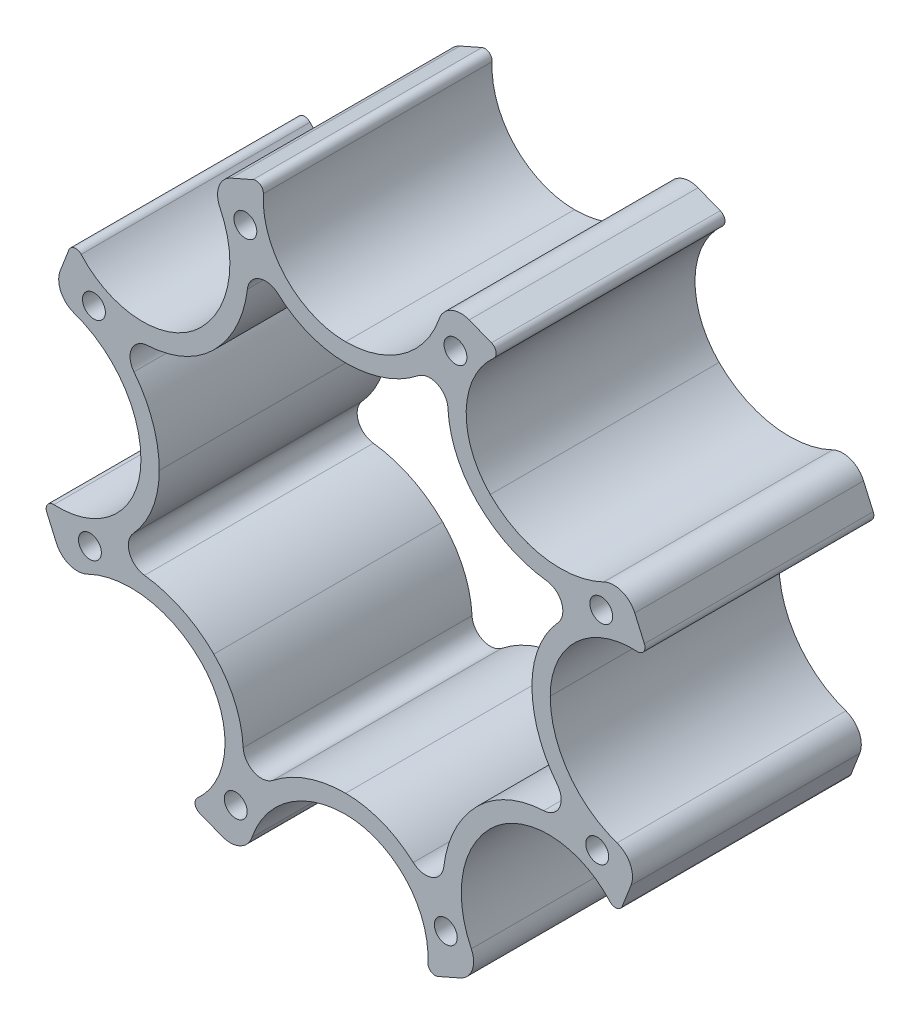
from build123d import *

# Parameters (mm, degrees)
EXTRUDE_1_DEPTH        = 25
CUT_EXTRUDE_1_DEPTH    = 53.585134746
EXTRUDE_2_DEPTH        = 4
SKETCH_4_R             = 3.5
SKETCH_4_R_2           = 1.7
SKETCH_4_R_3           = 2.3
CUT_EXTRUDE_2_DEPTH    = 55.600333298
SKETCH_5_R             = 50
CUT_EXTRUDE_3_DEPTH    = 4
HOLE_WIZARD_M3_1_D     = 2.5
HOLE_WIZARD_M3_1_DEPTH = 11.5
HOLE_WIZARD_M3_1_TIP   = 0.751075774


with BuildPart() as part:
    # 草图1 → 凸台-拉伸1 (new body)
    with BuildSketch(Plane.XY):
        with BuildLine():
            Line((15.936762996, 30.229618981), (13.50337588, 31.175538906))
            ThreePointArc((13.50337588, 31.175538906), (11.545587701, 31.113280948), (10.233613318, 29.658793469))
            ThreePointArc((10.233613318, 29.658793469), (6.285609854, 24.369935979), (0, 22.357511157))
            ThreePointArc((0, 22.357511157), (-6.541634269, 25.176328334), (-8.985563862, 31.867062025))
            ThreePointArc((-8.985563862, 31.867062025), (-9.328351981, 32.569720668), (-10.106575389, 32.644561759))
            Line((-10.106575389, 32.644561759), (-12.496106314, 31.592763621))
            ThreePointArc((-12.496106314, 31.592763621), (-13.836448588, 30.1643753), (-13.73567661, 28.208191357))
            ThreePointArc((-13.73567661, 28.208191357), (-12.787549636, 21.67674434), (-15.80914775, 15.80914775))
            ThreePointArc((-15.80914775, 15.80914775), (-22.427986442, 13.176718539), (-28.887168794, 16.179662515))
            ThreePointArc((-28.887168794, 16.179662515), (-29.626411288, 16.434129403), (-30.229618981, 15.936762996))
            Line((-30.229618981, 15.936762996), (-31.175538906, 13.50337588))
            ThreePointArc((-31.175538906, 13.50337588), (-31.113280948, 11.545587701), (-29.658793469, 10.233613318))
            ThreePointArc((-29.658793469, 10.233613318), (-24.369935979, 6.285609854), (-22.357511157, 0))
            ThreePointArc((-22.357511157, 0), (-25.176328334, -6.541634269), (-31.867062025, -8.985563862))
            ThreePointArc((-31.867062025, -8.985563862), (-32.569720668, -9.328351981), (-32.644561759, -10.106575389))
            Line((-32.644561759, -10.106575389), (-31.592763621, -12.496106314))
            ThreePointArc((-31.592763621, -12.496106314), (-30.1643753, -13.836448588), (-28.208191357, -13.73567661))
            ThreePointArc((-28.208191357, -13.73567661), (-21.67674434, -12.787549636), (-15.80914775, -15.80914775))
            ThreePointArc((-15.80914775, -15.80914775), (-13.176718539, -22.427986442), (-16.179662515, -28.887168794))
            ThreePointArc((-16.179662515, -28.887168794), (-16.434129403, -29.626411288), (-15.936762996, -30.229618981))
            Line((-15.936762996, -30.229618981), (-13.50337588, -31.175538906))
            ThreePointArc((-13.50337588, -31.175538906), (-11.545587701, -31.113280948), (-10.233613318, -29.658793469))
            ThreePointArc((-10.233613318, -29.658793469), (-6.285609854, -24.369935979), (0, -22.357511157))
            ThreePointArc((0, -22.357511157), (6.541634269, -25.176328334), (8.985563862, -31.867062025))
            ThreePointArc((8.985563862, -31.867062025), (9.328351981, -32.569720668), (10.106575389, -32.644561759))
            Line((10.106575389, -32.644561759), (12.496106314, -31.592763621))
            ThreePointArc((12.496106314, -31.592763621), (13.836448588, -30.1643753), (13.73567661, -28.208191357))
            ThreePointArc((13.73567661, -28.208191357), (12.787549636, -21.67674434), (15.80914775, -15.80914775))
            ThreePointArc((15.80914775, -15.80914775), (22.427986442, -13.176718539), (28.887168794, -16.179662515))
            ThreePointArc((28.887168794, -16.179662515), (29.626411288, -16.434129403), (30.229618981, -15.936762996))
            Line((30.229618981, -15.936762996), (31.175538906, -13.50337588))
            ThreePointArc((31.175538906, -13.50337588), (31.113280948, -11.545587701), (29.658793469, -10.233613318))
            ThreePointArc((29.658793469, -10.233613318), (24.369935979, -6.285609854), (22.357511157, 0))
            ThreePointArc((22.357511157, 0), (25.176328334, 6.541634269), (31.867062025, 8.985563862))
            ThreePointArc((31.867062025, 8.985563862), (32.569720668, 9.328351981), (32.644561759, 10.106575389))
            Line((32.644561759, 10.106575389), (31.592763621, 12.496106314))
            ThreePointArc((31.592763621, 12.496106314), (30.1643753, 13.836448588), (28.208191357, 13.73567661))
            ThreePointArc((28.208191357, 13.73567661), (21.67674434, 12.787549636), (15.80914775, 15.80914775))
            ThreePointArc((15.80914775, 15.80914775), (13.176718539, 22.427986442), (16.179662515, 28.887168794))
            ThreePointArc((16.179662515, 28.887168794), (16.434129403, 29.626411288), (15.936762996, 30.229618981))
        make_face()
    extrude(amount=EXTRUDE_1_DEPTH)

    # 草图2 → 切除-拉伸1 (cut, through all)
    with BuildSketch(Plane(origin=(0, 0, 0), x_dir=(-1, 0, 0), z_dir=(0, 0, -1))):
        with BuildLine():
            ThreePointArc((20.357511157, 0), (21.09666185, -3.964211334), (23.214778703, -7.395668204))
            ThreePointArc((23.214778703, -7.395668204), (23.607260601, -9.441727167), (21.96737362, -10.726705772))
            ThreePointArc((21.96737362, -10.726705772), (17.87170053, -11.922005636), (14.394934187, -14.394934187))
            ThreePointArc((14.394934187, -14.394934187), (12.114471938, -17.720713371), (11.185800306, -21.644854583))
            ThreePointArc((11.185800306, -21.644854583), (10.01654475, -23.369163362), (7.948352461, -23.118205243))
            ThreePointArc((7.948352461, -23.118205243), (4.207069606, -21.067331667), (0, -20.357511157))
            ThreePointArc((0, -20.357511157), (-3.964211334, -21.09666185), (-7.395668204, -23.214778703))
            ThreePointArc((-7.395668204, -23.214778703), (-9.441727167, -23.607260601), (-10.726705772, -21.96737362))
            ThreePointArc((-10.726705772, -21.96737362), (-11.922005636, -17.87170053), (-14.394934187, -14.394934187))
            ThreePointArc((-14.394934187, -14.394934187), (-17.720713371, -12.114471938), (-21.644854583, -11.185800306))
            ThreePointArc((-21.644854583, -11.185800306), (-23.369163362, -10.01654475), (-23.118205243, -7.948352461))
            ThreePointArc((-23.118205243, -7.948352461), (-21.067331667, -4.207069606), (-20.357511157, 0))
            ThreePointArc((-20.357511157, 0), (-21.09666185, 3.964211334), (-23.214778703, 7.395668204))
            ThreePointArc((-23.214778703, 7.395668204), (-23.607260601, 9.441727167), (-21.96737362, 10.726705772))
            ThreePointArc((-21.96737362, 10.726705772), (-17.87170053, 11.922005636), (-14.394934187, 14.394934187))
            ThreePointArc((-14.394934187, 14.394934187), (-12.114471938, 17.720713371), (-11.185800306, 21.644854583))
            ThreePointArc((-11.185800306, 21.644854583), (-10.01654475, 23.369163362), (-7.948352461, 23.118205243))
            ThreePointArc((-7.948352461, 23.118205243), (-4.207069606, 21.067331667), (0, 20.357511157))
            ThreePointArc((0, 20.357511157), (3.964211334, 21.09666185), (7.395668204, 23.214778703))
            ThreePointArc((7.395668204, 23.214778703), (9.441727167, 23.607260601), (10.726705772, 21.96737362))
            ThreePointArc((10.726705772, 21.96737362), (11.922005636, 17.87170053), (14.394934187, 14.394934187))
            ThreePointArc((14.394934187, 14.394934187), (17.720713371, 12.114471938), (21.644854583, 11.185800306))
            ThreePointArc((21.644854583, 11.185800306), (23.369163362, 10.01654475), (23.118205243, 7.948352461))
            ThreePointArc((23.118205243, 7.948352461), (21.067331667, 4.207069606), (20.357511157, 0))
        make_face()
    extrude(amount=-CUT_EXTRUDE_1_DEPTH, mode=Mode.SUBTRACT)

    # 草图3 → 凸台-拉伸2 (add)
    with BuildSketch(Plane.XY.offset(25)):
        with BuildLine():
            Line((15.936762996, 30.229618981), (13.50337588, 31.175538906))
            ThreePointArc((13.50337588, 31.175538906), (11.545587701, 31.113280948), (10.233613318, 29.658793469))
            ThreePointArc((10.233613318, 29.658793469), (6.285609854, 24.369935979), (0, 22.357511157))
            ThreePointArc((0, 22.357511157), (-6.541634269, 25.176328334), (-8.985563862, 31.867062025))
            ThreePointArc((-8.985563862, 31.867062025), (-9.328351981, 32.569720668), (-10.106575389, 32.644561759))
            Line((-10.106575389, 32.644561759), (-12.496106314, 31.592763621))
            ThreePointArc((-12.496106314, 31.592763621), (-13.836448588, 30.1643753), (-13.73567661, 28.208191357))
            ThreePointArc((-13.73567661, 28.208191357), (-12.787549636, 21.67674434), (-15.80914775, 15.80914775))
            ThreePointArc((-15.80914775, 15.80914775), (-22.427986442, 13.176718539), (-28.887168794, 16.179662515))
            ThreePointArc((-28.887168794, 16.179662515), (-29.626411288, 16.434129403), (-30.229618981, 15.936762996))
            Line((-30.229618981, 15.936762996), (-31.175538906, 13.50337588))
            ThreePointArc((-31.175538906, 13.50337588), (-31.113280948, 11.545587701), (-29.658793469, 10.233613318))
            ThreePointArc((-29.658793469, 10.233613318), (-24.369935979, 6.285609854), (-22.357511157, 0))
            ThreePointArc((-22.357511157, 0), (-25.176328334, -6.541634269), (-31.867062025, -8.985563862))
            ThreePointArc((-31.867062025, -8.985563862), (-32.569720668, -9.328351981), (-32.644561759, -10.106575389))
            Line((-32.644561759, -10.106575389), (-31.592763621, -12.496106314))
            ThreePointArc((-31.592763621, -12.496106314), (-30.1643753, -13.836448588), (-28.208191357, -13.73567661))
            ThreePointArc((-28.208191357, -13.73567661), (-21.67674434, -12.787549636), (-15.80914775, -15.80914775))
            ThreePointArc((-15.80914775, -15.80914775), (-13.176718539, -22.427986442), (-16.179662515, -28.887168794))
            ThreePointArc((-16.179662515, -28.887168794), (-16.434129403, -29.626411288), (-15.936762996, -30.229618981))
            Line((-15.936762996, -30.229618981), (-13.50337588, -31.175538906))
            ThreePointArc((-13.50337588, -31.175538906), (-11.545587701, -31.113280948), (-10.233613318, -29.658793469))
            ThreePointArc((-10.233613318, -29.658793469), (-6.285609854, -24.369935979), (0, -22.357511157))
            ThreePointArc((0, -22.357511157), (6.541634269, -25.176328334), (8.985563862, -31.867062025))
            ThreePointArc((8.985563862, -31.867062025), (9.328351981, -32.569720668), (10.106575389, -32.644561759))
            Line((10.106575389, -32.644561759), (12.496106314, -31.592763621))
            ThreePointArc((12.496106314, -31.592763621), (13.836448588, -30.1643753), (13.73567661, -28.208191357))
            ThreePointArc((13.73567661, -28.208191357), (12.787549636, -21.67674434), (15.80914775, -15.80914775))
            ThreePointArc((15.80914775, -15.80914775), (22.427986442, -13.176718539), (28.887168794, -16.179662515))
            ThreePointArc((28.887168794, -16.179662515), (29.626411288, -16.434129403), (30.229618981, -15.936762996))
            Line((30.229618981, -15.936762996), (31.175538906, -13.50337588))
            ThreePointArc((31.175538906, -13.50337588), (31.113280948, -11.545587701), (29.658793469, -10.233613318))
            ThreePointArc((29.658793469, -10.233613318), (24.369935979, -6.285609854), (22.357511157, 0))
            ThreePointArc((22.357511157, 0), (25.176328334, 6.541634269), (31.867062025, 8.985563862))
            ThreePointArc((31.867062025, 8.985563862), (32.569720668, 9.328351981), (32.644561759, 10.106575389))
            Line((32.644561759, 10.106575389), (31.592763621, 12.496106314))
            ThreePointArc((31.592763621, 12.496106314), (30.1643753, 13.836448588), (28.208191357, 13.73567661))
            ThreePointArc((28.208191357, 13.73567661), (21.67674434, 12.787549636), (15.80914775, 15.80914775))
            ThreePointArc((15.80914775, 15.80914775), (13.176718539, 22.427986442), (16.179662515, 28.887168794))
            ThreePointArc((16.179662515, 28.887168794), (16.434129403, 29.626411288), (15.936762996, 30.229618981))
        make_face()
    extrude(amount=EXTRUDE_2_DEPTH)

    # 草图4 → 切除-拉伸2 (cut, through all)
    with BuildSketch(Plane.XY.offset(29)):
        Circle(SKETCH_4_R)
        with Locations((8, 0)):
            Circle(SKETCH_4_R_2)
        with Locations((0, -8)):
            Circle(SKETCH_4_R_2)
        with Locations((-8, 0)):
            Circle(SKETCH_4_R_2)
        with Locations((0, 8)):
            Circle(SKETCH_4_R_2)
        with Locations((-9.234972265, 17.740216664)):
            Circle(SKETCH_4_R_3)
        with Locations((17.740216664, 9.234972265)):
            Circle(SKETCH_4_R_3)
        with Locations((9.234972265, -17.740216664)):
            Circle(SKETCH_4_R_3)
        with Locations((-17.740216664, -9.234972265)):
            Circle(SKETCH_4_R_3)
    extrude(amount=-CUT_EXTRUDE_2_DEPTH, mode=Mode.SUBTRACT)

    # 草图5 → 切除-拉伸3 (cut)
    with BuildSketch(Plane.XY.offset(29)):
        Circle(SKETCH_5_R)
    extrude(amount=-CUT_EXTRUDE_3_DEPTH, mode=Mode.SUBTRACT)

    # M3 螺纹孔1
    with Locations(Plane.XY.offset(25)):
        with Locations((-10.95008804, 27.930191047), (12.006745981, 27.492508997), (27.930191047, 10.95008804), (27.492508997, -12.006745981), (10.95008804, -27.930191047), (-12.006745981, -27.492508997), (-27.930191047, -10.95008804), (-27.492508997, 12.006745981)):
            Hole(HOLE_WIZARD_M3_1_D / 2, depth=HOLE_WIZARD_M3_1_DEPTH)
            with Locations((0, 0, -(HOLE_WIZARD_M3_1_DEPTH + HOLE_WIZARD_M3_1_TIP / 2))):  # 118° drill point
                Cone(0, HOLE_WIZARD_M3_1_D / 2, HOLE_WIZARD_M3_1_TIP, mode=Mode.SUBTRACT)


solid = part.part
